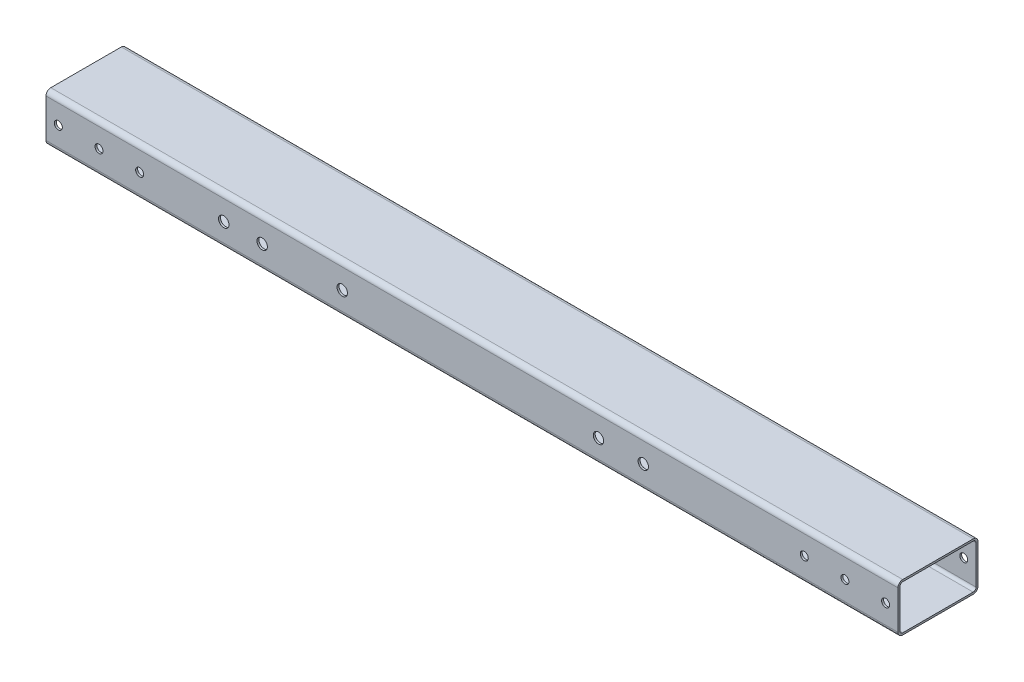
from build123d import *

# Parameters (mm, degrees)
TUBO_RETANGULAR_50_X_30_X_2_6_1_DEPTH = 532
ESBO_O2_R                             = 2.5
CORTE_EXTRUS_O1_DEPTH                 = 535.554955079
ESBO_O3_R                             = 3.25
CORTE_EXTRUS_O2_DEPTH                 = 535.554955079
ESBO_O4_R                             = 3.25
CORTE_EXTRUS_O3_DEPTH                 = 535.554955079


with BuildPart() as part:
    # Sketch1 → Tubo retangular 50 X 30 X 2.6(1) (new body)
    with BuildSketch(Plane.YZ):
        with BuildLine():
            Line((-12, -25), (12, -25))
            ThreePointArc((12, -25), (14.121320344, -24.121320344), (15, -22))
            Line((15, -22), (15, 22))
            ThreePointArc((15, 22), (14.121320344, 24.121320344), (12, 25))
            Line((12, 25), (-12, 25))
            ThreePointArc((-12, 25), (-14.121320344, 24.121320344), (-15, 22))
            Line((-15, 22), (-15, -22))
            ThreePointArc((-15, -22), (-14.121320344, -24.121320344), (-12, -25))
        make_face()
        with BuildLine():
            Line((-12, -23.8), (12, -23.8))
            ThreePointArc((12, -23.8), (13.272792206, -23.272792206), (13.8, -22))
            Line((13.8, -22), (13.8, 22))
            ThreePointArc((13.8, 22), (13.272792206, 23.272792206), (12, 23.8))
            Line((12, 23.8), (-12, 23.8))
            ThreePointArc((-12, 23.8), (-13.272792206, 23.272792206), (-13.8, 22))
            Line((-13.8, 22), (-13.8, -22))
            ThreePointArc((-13.8, -22), (-13.272792206, -23.272792206), (-12, -23.8))
        make_face(mode=Mode.SUBTRACT)
    extrude(amount=TUBO_RETANGULAR_50_X_30_X_2_6_1_DEPTH)

    # Esboço2 → Corte-extrusão1 (cut, through all)
    with BuildSketch(Plane(origin=(0, 0, -25), x_dir=(-1, 0, 0), z_dir=(0, 0, -1))):
        with Locations((-58.5, 0)):
            Circle(ESBO_O2_R)
        with Locations((-33.1, 0)):
            Circle(ESBO_O2_R)
        with Locations((-7.7, 0)):
            Circle(ESBO_O2_R)
        with Locations(Location((-524.3, 0, 0), (0, 0, 180))):
            Circle(ESBO_O2_R)
        with Locations(Location((-498.9, 0, 0), (0, 0, 180))):
            Circle(ESBO_O2_R)
        with Locations(Location((-473.5, 0, 0), (0, 0, 180))):
            Circle(ESBO_O2_R)
    extrude(amount=-CORTE_EXTRUS_O1_DEPTH, mode=Mode.SUBTRACT)

    # Esboço3 → Corte-extrusão2 (cut, through all)
    with BuildSketch(Plane(origin=(0, 0, -25), x_dir=(-1, 0, 0), z_dir=(0, 0, -1))):
        with Locations((-185, -0.5)):
            Circle(ESBO_O3_R)
        with Locations((-111, -0.5)):
            Circle(ESBO_O3_R)
        with Locations((-373, -0.5)):
            Circle(ESBO_O3_R)
    extrude(amount=-CORTE_EXTRUS_O2_DEPTH, mode=Mode.SUBTRACT)

    # Esboço4 → Corte-extrusão3 (cut, through all)
    with BuildSketch(Plane(origin=(0, 0, -25), x_dir=(-1, 0, 0), z_dir=(0, 0, -1))):
        with Locations((-345, -0.5)):
            Circle(ESBO_O4_R)
        with Locations((-135, -0.5)):
            Circle(ESBO_O4_R)
    extrude(amount=-CORTE_EXTRUS_O3_DEPTH, mode=Mode.SUBTRACT)


solid = part.part
